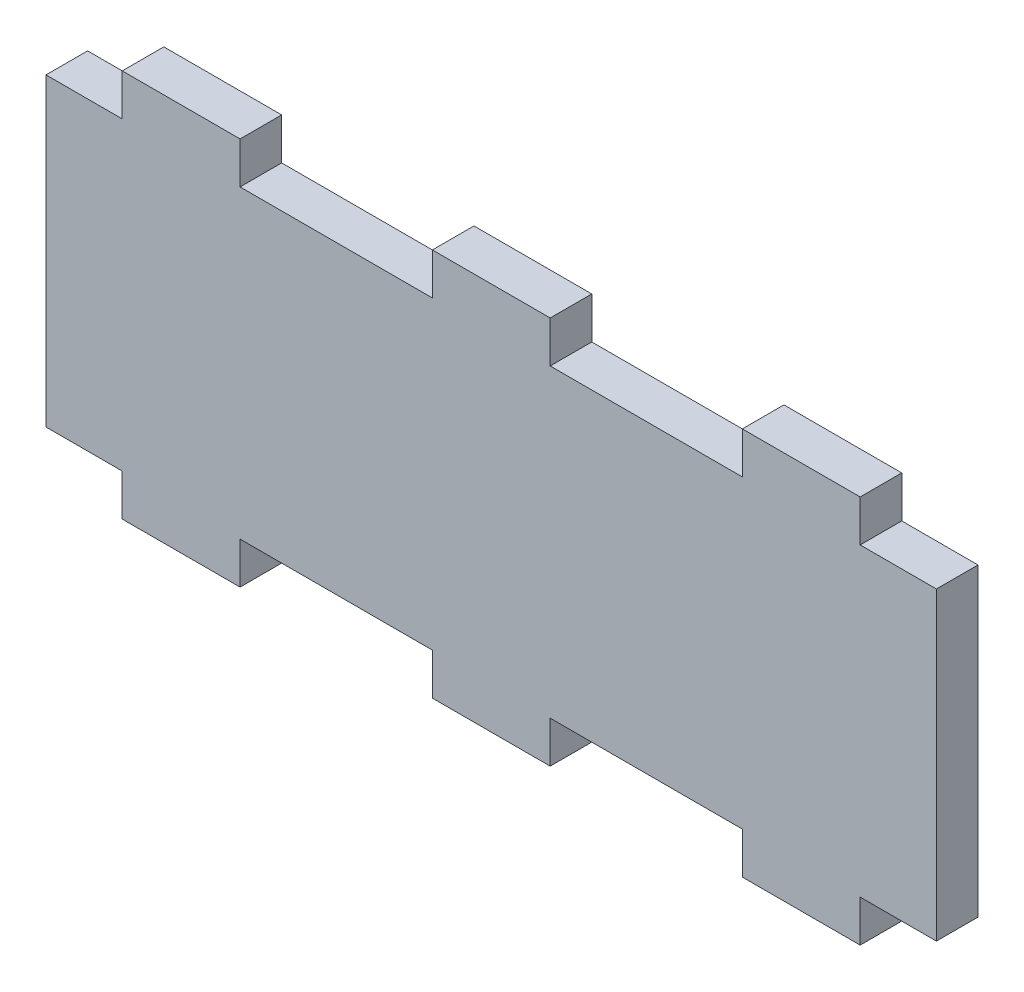
from build123d import *

# Parameters (mm, degrees)
SALIENTE_EXTRUIR1_DEPTH = 3


with BuildPart() as part:
    # Croquis1 → Saliente-Extruir1 (new body)
    with BuildSketch(Plane.XY):
        Polygon((17, 0), (30.87, 0), (30.87, -3), (39.37, -3), (39.37, 0), (53.23, 0), (53.23, -3), (61.73, -3), (61.73, 0), (67.23, 0), (67.23, 22), (61.73, 22), (61.73, 25), (53.23, 25), (53.23, 22), (39.37, 22), (39.37, 25), (30.87, 25), (30.87, 22), (17, 22), (17, 25), (8.5, 25), (8.5, 22), (3, 22), (3, 0), (8.5, 0), (8.5, -3), (17, -3), align=None)
    extrude(amount=SALIENTE_EXTRUIR1_DEPTH)


solid = part.part
